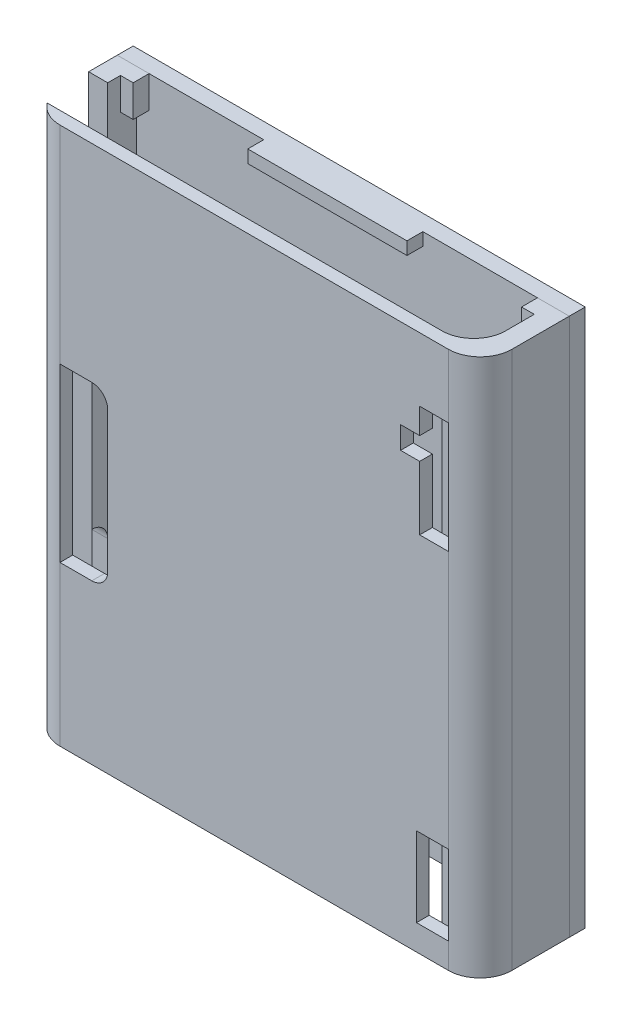
from build123d import *

# Parameters (mm, degrees)
SKETCH_2_W          = 130
SKETCH_2_H          = 169
EXTRUDE_1_DEPTH     = 5
SKETCH_3_W          = 50
SKETCH_3_H          = 4
SKETCH_3_W_2        = 4
SKETCH_3_H_2        = 89
EXTRUDE_2_DEPTH     = 5
EXTRUDE_3_DEPTH     = 89
SKETCH_5_W          = 6
SKETCH_5_H          = 169
EXTRUDE_4_DEPTH     = 5
EXTRUDE_5_DEPTH     = 169
SKETCH_7_W          = 4
SKETCH_7_H          = 10
EXTRUDE_6_DEPTH     = 5
SKETCH_8_R          = 2.2
CUT_EXTRUDE_1_DEPTH = 9
CUT_EXTRUDE_START   = -16
CUT_EXTRUDE_2_DEPTH = 16
SKETCH_10_W         = 10
SKETCH_10_H         = 25
CUT_EXTRUDE_3_DEPTH = 4


with BuildPart() as part:
    # 草图2 → 凸台-拉伸1 (new body)
    with BuildSketch(Plane.XY):
        with Locations((26.209829868, -55.917769376)):
            Rectangle(SKETCH_2_W, SKETCH_2_H)
    extrude(amount=EXTRUDE_1_DEPTH)

    # 草图3 → 凸台-拉伸2 (add)
    with BuildSketch(Plane.XY.offset(5)):
        with Locations((26.209829868, 26.582230624)):
            Rectangle(SKETCH_3_W, SKETCH_3_H)
        with Locations((-36.790170132, -55.917769376)):
            Rectangle(SKETCH_3_W_2, SKETCH_3_H_2)
        with Locations((26.209829868, -138.417769376)):
            Rectangle(SKETCH_3_W, SKETCH_3_H)
        with Locations((89.209829868, -55.917769376)):
            Rectangle(SKETCH_3_W_2, SKETCH_3_H_2)
    extrude(amount=EXTRUDE_2_DEPTH)

    # 草图4 → 凸台-拉伸3 (add)
    with BuildSketch(Plane(origin=(0, -11.417769376, 0), x_dir=(1, 0, 0), z_dir=(0, 1, 0))):
        Polygon((85.209829868, -10), (87.209829868, -10), (91.209829868, -10), (91.209829868, -12), (86.209829868, -12), align=None)
    extrude(amount=-EXTRUDE_3_DEPTH)

    # 草图5 → 凸台-拉伸4 (add)
    with BuildSketch(Plane.XY.offset(5)):
        with Locations((-41.790170132, -55.917769376)):
            Rectangle(SKETCH_5_W, SKETCH_5_H)
        with Locations((94.209829868, -55.917769376)):
            Rectangle(SKETCH_5_W, SKETCH_5_H)
    extrude(amount=-EXTRUDE_4_DEPTH)


with BuildPart() as body_2:
    # 草图6 → 凸台-拉伸5 (new body)
    with BuildSketch(Plane(origin=(0, 28.582230624, 0), x_dir=(1, 0, 0), z_dir=(0, 1, 0))):
        with BuildLine():
            Line((-38.790170132, -5), (-44.790170132, -5))
            Line((-44.790170132, -5), (-44.790170132, -23))
            ThreePointArc((-44.790170132, -23), (-43.156770398, -28.477225575), (-38.790170132, -32.16515139))
            ThreePointArc((-38.790170132, -32.16515139), (-36.833266569, -32.789063129), (-34.790170132, -33))
            Line((-34.790170132, -33), (87.209829868, -33))
            ThreePointArc((87.209829868, -33), (94.28089768, -30.071067812), (97.209829868, -23))
            Line((97.209829868, -23), (97.209829868, -5))
            Line((97.209829868, -5), (91.209829868, -5))
            Line((91.209829868, -5), (91.209829868, -19))
            ThreePointArc((91.209829868, -19), (88.28089768, -26.071067812), (81.209829868, -29))
            Line((81.209829868, -29), (-28.790170132, -29))
            ThreePointArc((-28.790170132, -29), (-35.861237944, -26.071067812), (-38.790170132, -19))
            Line((-38.790170132, -19), (-38.790170132, -5))
        make_face()
    extrude(amount=-EXTRUDE_5_DEPTH)

    # 草图7 → 凸台-拉伸6 (add)
    with BuildSketch(Plane.XY.offset(5)):
        with Locations((-36.790170132, -135.417769376)):
            Rectangle(SKETCH_7_W, SKETCH_7_H)
        with Locations((-36.790170132, 23.582230624)):
            Rectangle(SKETCH_7_W, SKETCH_7_H)
        with Locations((89.209829868, 23.582230624)):
            Rectangle(SKETCH_7_W, SKETCH_7_H)
        with Locations((89.209829868, -135.417769376)):
            Rectangle(SKETCH_7_W, SKETCH_7_H)
    extrude(amount=EXTRUDE_6_DEPTH)


with BuildPart() as cut_extrude_1_tool:
    # 草图8 → 切除-拉伸1 (new body)
    with BuildSketch(Plane(origin=(0, 0, 0), x_dir=(-1, 0, 0), z_dir=(0, 0, -1))):
        with Locations((39.790170132, -135.417769376)):
            Circle(SKETCH_8_R)
        with Locations((39.790170132, 23.582230624)):
            Circle(SKETCH_8_R)
        with Locations((-92.209829868, 23.582230624)):
            Circle(SKETCH_8_R)
        with Locations((-92.209829868, -135.417769376)):
            Circle(SKETCH_8_R)
    extrude(amount=-CUT_EXTRUDE_1_DEPTH)


with BuildPart() as part_1:
    add(part.part)

    # 切除-拉伸1: cut by cut_extrude_1_tool
    add(cut_extrude_1_tool.part, mode=Mode.SUBTRACT)


with BuildPart() as body_2_1:
    add(body_2.part)

    # 切除-拉伸1: cut by cut_extrude_1_tool
    add(cut_extrude_1_tool.part, mode=Mode.SUBTRACT)

    # 草图9 → 切除-拉伸2 (cut)
    with BuildSketch(Plane.ZY.offset(44.790170132).offset(CUT_EXTRUDE_START)):
        with BuildLine():
            Line((14, -95.417769376), (14, -140.417769376))
            Line((14, -140.417769376), (23, -140.417769376))
            Line((23, -140.417769376), (23, -90.417769376))
            Line((23, -90.417769376), (19, -90.417769376))
            ThreePointArc((19, -90.417769376), (15.464466094, -91.88223547), (14, -95.417769376))
        make_face()
        with BuildLine():
            Line((23, -90.417769376), (23, -140.417769376))
            Line((23, -140.417769376), (29, -140.417769376))
            Line((29, -140.417769376), (29, -95.417769376))
            ThreePointArc((29, -95.417769376), (27.535533906, -91.88223547), (24, -90.417769376))
            Line((24, -90.417769376), (23, -90.417769376))
        make_face()
        with BuildLine():
            Line((23, 28.582230624), (23, -36.417769376))
            Line((23, -36.417769376), (24, -36.417769376))
            ThreePointArc((24, -36.417769376), (27.535533906, -34.953303282), (29, -31.417769376))
            Line((29, -31.417769376), (29, 28.582230624))
            Line((29, 28.582230624), (23, 28.582230624))
        make_face()
        with BuildLine():
            Line((19, -36.417769376), (23, -36.417769376))
            Line((23, -36.417769376), (23, 28.582230624))
            Line((23, 28.582230624), (14, 28.582230624))
            Line((14, 28.582230624), (14, -31.417769376))
            ThreePointArc((14, -31.417769376), (15.464466094, -34.953303282), (19, -36.417769376))
        make_face()
    extrude(amount=CUT_EXTRUDE_2_DEPTH, mode=Mode.SUBTRACT)

    # 草图10 → 切除-拉伸3 (cut)
    with BuildSketch(Plane.XY.offset(33)):
        with BuildLine():
            Line((-34.790170132, -36.417769376), (-34.790170132, -90.417769376))
            Line((-34.790170132, -90.417769376), (-24.790170132, -90.417769376))
            ThreePointArc((-24.790170132, -90.417769376), (-21.254636226, -88.953303282), (-19.790170132, -85.417769376))
            Line((-19.790170132, -85.417769376), (-19.790170132, -41.417769376))
            ThreePointArc((-19.790170132, -41.417769376), (-21.254636226, -37.88223547), (-24.790170132, -36.417769376))
            Line((-24.790170132, -36.417769376), (-34.790170132, -36.417769376))
        make_face()
        Polygon((87.209829868, -26.417769376), (87.209829868, -11.417769376), (87.209829868, 8.582230624), (78.209829868, 8.582230624), (78.209829868, 0.582230624), (72.209829868, 0.582230624), (72.209829868, -6.417769376), (78.209829868, -6.417769376), (78.209829868, -26.417769376), align=None)
        with Locations((82.209829868, -119.917769376)):
            Rectangle(SKETCH_10_W, SKETCH_10_H)
    extrude(amount=-CUT_EXTRUDE_3_DEPTH, mode=Mode.SUBTRACT)


solid = Compound([part_1.part, body_2_1.part])
